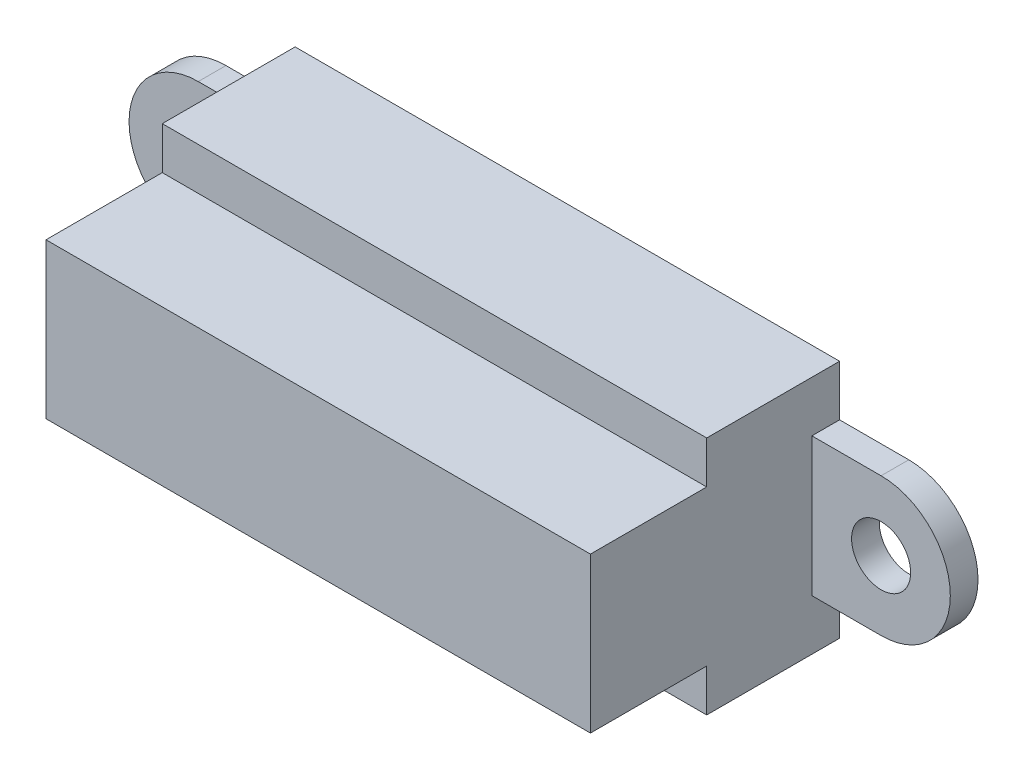
from build123d import *

# Parameters (mm, degrees)
SKETCH_1_R      = 1.6
EXTRUDE_1_DEPTH = 1.5
SKETCH_2_W      = 29.5
SKETCH_2_H      = 3.75
SKETCH_2_H_2    = 2.75
EXTRUDE_2_DEPTH = 7.2
SKETCH_3_W      = 29.5
SKETCH_3_H      = 8.4
EXTRUDE_3_DEPTH = 6.3


with BuildPart() as part:
    # ｽｹｯﾁ1 → ﾎﾞｽ - 押し出し1 (new body)
    with BuildSketch(Plane.XY):
        with BuildLine():
            Line((0, 3.75), (37, 3.75))
            ThreePointArc((37, 3.75), (40.75, 0), (37, -3.75))
            Line((37, -3.75), (0, -3.75))
            ThreePointArc((0, -3.75), (-3.75, 0), (0, 3.75))
        make_face()
        Circle(SKETCH_1_R, mode=Mode.SUBTRACT)
        with Locations((37, 0)):
            Circle(SKETCH_1_R, mode=Mode.SUBTRACT)
    extrude(amount=EXTRUDE_1_DEPTH)

    # ｽｹｯﾁ2 → ﾎﾞｽ - 押し出し2 (add)
    with BuildSketch(Plane(origin=(0, 0, 0), x_dir=(-1, 0, 0), z_dir=(0, 0, -1))):
        with Locations((-18.5, -1.875)):
            Rectangle(SKETCH_2_W, SKETCH_2_H)
        with Locations((-18.5, 1.875)):
            Rectangle(SKETCH_2_W, SKETCH_2_H)
        with Locations((-18.5, 5.125)):
            Rectangle(SKETCH_2_W, SKETCH_2_H_2)
        with Locations((-18.5, -5.125)):
            Rectangle(SKETCH_2_W, SKETCH_2_H_2)
    extrude(amount=-EXTRUDE_2_DEPTH)

    # ｽｹｯﾁ3 → ﾎﾞｽ - 押し出し3 (add)
    with BuildSketch(Plane.XY.offset(7.2)):
        with Locations((18.5, 0)):
            Rectangle(SKETCH_3_W, SKETCH_3_H)
    extrude(amount=EXTRUDE_3_DEPTH)


solid = part.part
